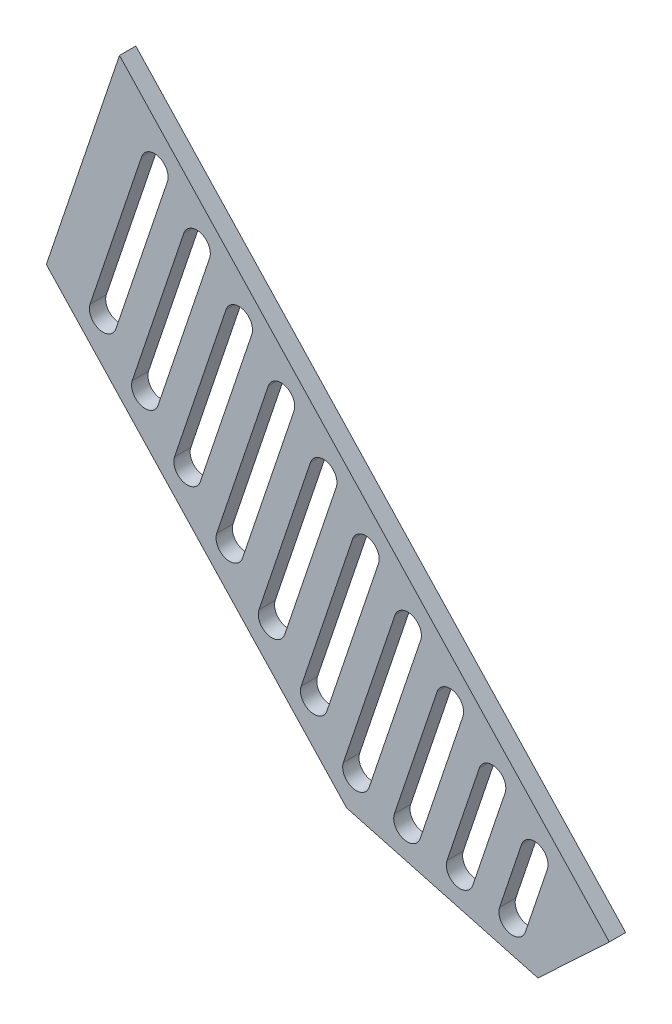
from build123d import *

# Parameters (mm, degrees)
BOSS_EXTRUDE1_DEPTH = 3
CUT_EXTRUDE1_DEPTH  = 3


with BuildPart() as part:
    # Sketch1 → Boss-Extrude1 (new body)
    with BuildSketch(Plane(origin=(766.479324321, -257.616944778, 0), x_dir=(0.26047542598858736, 0.9654804775116191, 0), z_dir=(0, 0, 1))):
        Polygon((33.772102577, 853.041764539), (33.772102577, 816.600953816), (49.075102345, 807.123707481), (118.453517154, 919.149693533), (76.300457153, 921.712703038), align=None)
    extrude(amount=BOSS_EXTRUDE1_DEPTH)

    # Sketch2 → Cut-Extrude1 (cut)
    with BuildSketch(Plane(origin=(0, 0, 3), x_dir=(0.26047542598858736, 0.965480477511619, 0), z_dir=(0, 0, 1))):
        with BuildLine():
            Line((20.841316823, 91.584158174), (50.525265903, 89.779301217))
            ThreePointArc((50.525265903, 89.779301217), (53.172383437, 92.122966884), (50.82871777, 94.770084418))
            Line((50.82871777, 94.770084418), (21.144768691, 96.574941376))
            ThreePointArc((21.144768691, 96.574941376), (18.497651156, 94.231275709), (20.841316823, 91.584158174))
        make_face()
        with BuildLine():
            Line((14.861969696, 81.929249515), (44.545918775, 80.124392558))
            ThreePointArc((44.545918775, 80.124392558), (47.19303631, 82.468058225), (44.849370643, 85.115175759))
            Line((44.849370643, 85.115175759), (15.165421563, 86.920032717))
            ThreePointArc((15.165421563, 86.920032717), (12.518304029, 84.57636705), (14.861969696, 81.929249515))
        make_face()
        with BuildLine():
            Line((27.124115818, 106.229850035), (56.808064898, 104.424993077))
            ThreePointArc((56.808064898, 104.424993077), (59.151730565, 101.777875543), (56.50461303, 99.434209876))
            Line((56.50461303, 99.434209876), (26.82066395, 101.239066833))
            ThreePointArc((26.82066395, 101.239066833), (24.476998283, 103.886184368), (27.124115818, 106.229850035))
        make_face()
        with BuildLine():
            Line((8.882622568, 72.274340856), (38.566571648, 70.469483899))
            ThreePointArc((38.566571648, 70.469483899), (41.213689182, 72.813149566), (38.870023515, 75.4602671))
            Line((38.870023515, 75.4602671), (9.186074436, 77.265124058))
            ThreePointArc((9.186074436, 77.265124058), (6.538956901, 74.921458391), (8.882622568, 72.274340856))
        make_face()
        with BuildLine():
            Line((2.903275441, 62.619432197), (32.58722452, 60.814575239))
            ThreePointArc((32.58722452, 60.814575239), (35.234342055, 63.158240906), (32.890676388, 65.805358441))
            Line((32.890676388, 65.805358441), (3.206727308, 67.610215399))
            ThreePointArc((3.206727308, 67.610215399), (0.559609774, 65.266549732), (2.903275441, 62.619432197))
        make_face()
        with BuildLine():
            Line((-3.076071687, 52.964523538), (26.607877393, 51.15966658))
            ThreePointArc((26.607877393, 51.15966658), (29.254994927, 53.503332247), (26.911329261, 56.150449782))
            Line((26.911329261, 56.150449782), (-2.772619819, 57.95530674))
            ThreePointArc((-2.772619819, 57.95530674), (-5.419737354, 55.611641073), (-3.076071687, 52.964523538))
        make_face()
        with BuildLine():
            Line((-9.055418814, 43.309614879), (20.628530266, 41.504757921))
            ThreePointArc((20.628530266, 41.504757921), (23.2756478, 43.848423588), (20.931982133, 46.495541123))
            Line((20.931982133, 46.495541123), (-8.751966947, 48.30039808))
            ThreePointArc((-8.751966947, 48.30039808), (-11.399084481, 45.956732414), (-9.055418814, 43.309614879))
        make_face()
        with BuildLine():
            Line((-9.651273834, 38.336610507), (14.952635006, 36.840632464))
            ThreePointArc((14.952635006, 36.840632464), (17.296300673, 34.193514929), (14.649183138, 31.849849262))
            Line((14.649183138, 31.849849262), (-9.954725702, 33.345827305))
            ThreePointArc((-9.954725702, 33.345827305), (-12.298391369, 35.99294484), (-9.651273834, 38.336610507))
        make_face()
        with BuildLine():
            Line((-9.651273834, 28.318142867), (8.973287878, 27.185723805))
            ThreePointArc((8.973287878, 27.185723805), (11.316953545, 24.53860627), (8.669836011, 22.194940603))
            Line((8.669836011, 22.194940603), (-9.954725702, 23.327359666))
            ThreePointArc((-9.954725702, 23.327359666), (-12.298391369, 25.9744772), (-9.651273834, 28.318142867))
        make_face()
        with BuildLine():
            Line((-9.651273834, 18.299675228), (2.993940751, 17.530815146))
            ThreePointArc((2.993940751, 17.530815146), (5.337606418, 14.883697611), (2.690488883, 12.540031944))
            Line((2.690488883, 12.540031944), (-9.954725702, 13.308892026))
            ThreePointArc((-9.954725702, 13.308892026), (-12.298391369, 15.956009561), (-9.651273834, 18.299675228))
        make_face()
    extrude(amount=-CUT_EXTRUDE1_DEPTH, mode=Mode.SUBTRACT)


solid = part.part
